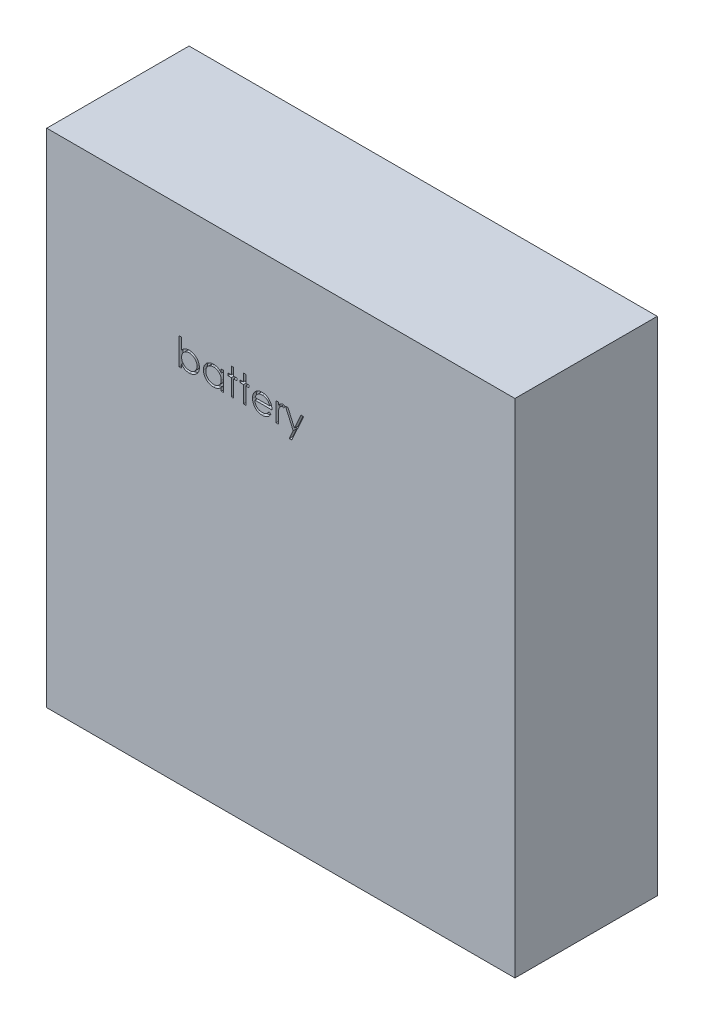
from build123d import *

# Parameters (mm, degrees)
SKETCH1_W           = 62.5
SKETCH1_H           = 67
BOSS_EXTRUDE1_DEPTH = 19
CUT_EXTRUDE1_DEPTH  = 0.5


with BuildPart() as part:
    # Sketch1 → Boss-Extrude1 (new body)
    with BuildSketch(Plane.XY):
        with Locations((31.25, 33.5)):
            Rectangle(SKETCH1_W, SKETCH1_H)
    extrude(amount=BOSS_EXTRUDE1_DEPTH)

    # Sketch2 → Cut-Extrude1 (cut)
    # profile 1 of 7: a face of its own
    with BuildSketch(Plane.XY.offset(19)):
        with BuildLine():
            Line((17.685046553, 48.241424132), (17.685046553, 51.831167722))
            Line((17.685046553, 51.831167722), (17.999149117, 51.831167722))
            Line((17.999149117, 51.831167722), (17.999149117, 50.334973811))
            add(Edge.make_bspline(
                [(17.999149117, 50.334973811), (18.034542536, 50.375731743), (18.103596556, 50.455252149), (18.219373007, 50.559099798), (18.340778576, 50.647152276), (18.468736832, 50.719738394), (18.603429765, 50.775012001), (18.744161874, 50.815434391), (18.891292915, 50.839821294), (18.991612089, 50.842587367), (19.042418348, 50.843988234)],
                knots=[0, 0, 0, 0, 1.077089805, 2.101446609, 3.097517232, 4.067117542, 5.031729543, 5.997785507, 6.985986182, 8, 8, 8, 8], degree=3))
            add(Edge.make_bspline(
                [(19.042418348, 50.843988234), (19.087584486, 50.842748006), (19.176885638, 50.840295864), (19.308167785, 50.821661368), (19.43448106, 50.791443567), (19.555756708, 50.749551387), (19.67142884, 50.69396841), (19.782487897, 50.627427102), (19.888364882, 50.548188773), (19.987419767, 50.457590462), (20.078713654, 50.359233839), (20.158626164, 50.254053524), (20.22612586, 50.143578434), (20.281957153, 50.028178371), (20.325128205, 49.90738202), (20.354870473, 49.781307822), (20.373763937, 49.650079803), (20.376144183, 49.560766999), (20.377354245, 49.515362433)],
                knots=[0, 0, 0, 0, 1.034377878, 2.045141349, 3.03070803, 4.00595497, 4.978199603, 5.965204761, 6.967410914, 8.002051993, 9.036360596, 10.037508045, 11.022711142, 11.997267194, 12.969246472, 13.954813154, 14.960274251, 16, 16, 16, 16], degree=3))
            add(Edge.make_bspline(
                [(20.377354245, 49.515362433), (20.376117805, 49.470662415), (20.373679739, 49.38252102), (20.355058431, 49.252814464), (20.324312166, 49.127975765), (20.280350983, 49.008327507), (20.225086044, 48.893307594), (20.155974768, 48.78422719), (20.076163769, 48.679188214), (19.98383262, 48.581564583), (19.883919068, 48.491331183), (19.777004825, 48.412925318), (19.665782903, 48.345208198), (19.548519791, 48.29155275), (19.426951749, 48.248151829), (19.299776363, 48.218034138), (19.167713135, 48.200461083), (19.077994246, 48.197865516), (19.032602643, 48.196552337)],
                knots=[0, 0, 0, 0, 1.024244038, 2.01964794, 2.996620209, 3.965911562, 4.936179293, 5.91563013, 6.920572822, 7.955171681, 8.990768464, 10.002129126, 10.989675881, 11.969873457, 12.952483066, 13.943799762, 14.959703725, 16, 16, 16, 16], degree=3))
            add(Edge.make_bspline(
                [(19.032602643, 48.196552337), (18.980637531, 48.197992945), (18.878743006, 48.200817727), (18.729690341, 48.224236706), (18.588608791, 48.264098316), (18.453891243, 48.317660072), (18.32746352, 48.390188726), (18.208522938, 48.480145476), (18.097819565, 48.589012613), (18.03260275, 48.672074103), (17.999149117, 48.714681343)],
                knots=[0, 0, 0, 0, 1.035807596, 2.031038093, 2.998900396, 3.954262848, 4.914341711, 5.895762244, 6.92060972, 8, 8, 8, 8], degree=3))
            Line((17.999149117, 48.714681343), (17.999149117, 48.241424132))
            Line((17.999149117, 48.241424132), (17.685046553, 48.241424132))
        make_face()
        with BuildLine():
            add(Edge.make_bspline(
                [(19.029798156, 48.510654901), (19.075712508, 48.51228853), (19.166340137, 48.515513054), (19.299383927, 48.540686677), (19.426698137, 48.582570791), (19.547641219, 48.639854499), (19.660320531, 48.711876534), (19.760973165, 48.799022704), (19.850452875, 48.898524219), (19.925104651, 49.010757912), (19.987430895, 49.130208881), (20.030244171, 49.255863183), (20.058963893, 49.384357972), (20.061816191, 49.471504016), (20.063251681, 49.515362433)],
                knots=[0, 0, 0, 0, 1.031910345, 2.036826888, 3.032245421, 4.038315463, 5.03827337, 6.029480047, 7.023177075, 8.037597977, 9.052889626, 10.043399556, 11.015292101, 12, 12, 12, 12], degree=3))
            add(Edge.make_bspline(
                [(20.063251681, 49.515362433), (20.061363937, 49.559177975), (20.057595986, 49.646634136), (20.031221203, 49.776283803), (19.985163413, 49.901871428), (19.92404539, 50.023049416), (19.848177405, 50.136057217), (19.759171441, 50.237547344), (19.657289635, 50.325107328), (19.544466216, 50.398097399), (19.424286025, 50.457656952), (19.297795392, 50.498501978), (19.167637269, 50.525240165), (19.079241776, 50.528329293), (19.034706008, 50.52988567)],
                knots=[0, 0, 0, 0, 0.984795267, 1.965658976, 2.959410029, 3.983795688, 5.009594896, 6.01088574, 7.009236619, 8.019050059, 9.024672985, 10.014834719, 10.999826153, 12, 12, 12, 12], degree=3))
            add(Edge.make_bspline(
                [(19.034706008, 50.52988567), (18.989238501, 50.528330173), (18.898994724, 50.525242826), (18.765826502, 50.498455002), (18.635763218, 50.457407391), (18.511475686, 50.398476041), (18.395621631, 50.326364581), (18.292009019, 50.241624381), (18.202677461, 50.144844473), (18.12913369, 50.036338671), (18.070728891, 49.919153636), (18.028945143, 49.794141433), (18.003945497, 49.66196012), (18.000767364, 49.571326915), (17.999149117, 49.525178138)],
                knots=[0, 0, 0, 0, 1.016820015, 2.018181405, 3.029022337, 4.06341356, 5.088169224, 6.076823655, 7.05054209, 8.02560866, 9.001194327, 9.972267242, 10.967515442, 12, 12, 12, 12], degree=3))
            add(Edge.make_bspline(
                [(17.999149117, 49.525178138), (18.000108788, 49.48984032), (18.001997723, 49.42028431), (18.016428091, 49.31815662), (18.039383753, 49.220423527), (18.071727247, 49.126978532), (18.114228482, 49.038352092), (18.165438747, 48.953856012), (18.226390394, 48.874252734), (18.295296983, 48.799737414), (18.371259364, 48.731927999), (18.452782483, 48.673149774), (18.538200414, 48.622535584), (18.628490384, 48.582190742), (18.722601675, 48.549264221), (18.821500016, 48.527530475), (18.92417144, 48.512555436), (18.994218538, 48.511295083), (19.029798156, 48.510654901)],
                knots=[0, 0, 0, 0, 1.050331198, 2.067384183, 3.060053655, 4.031335885, 5.001026174, 5.976994447, 6.963687968, 7.976578778, 8.990422448, 9.985569286, 10.960374351, 11.936812464, 12.921228065, 13.919088064, 14.943024695, 16, 16, 16, 16], degree=3))
        make_face(mode=Mode.SUBTRACT)
    # profile 2 of 7: a face of its own
    with BuildSketch(Plane.XY.offset(19)):
        with BuildLine():
            Line((23.608123476, 50.79911644), (23.608123476, 48.241424132))
            Line((23.608123476, 48.241424132), (23.294020912, 48.241424132))
            Line((23.294020912, 48.241424132), (23.294020912, 48.683831984))
            add(Edge.make_bspline(
                [(23.294020912, 48.683831984), (23.258602121, 48.643792391), (23.189481906, 48.565654619), (23.074040788, 48.463572447), (22.95167261, 48.379194125), (22.822971289, 48.31104421), (22.688053046, 48.259852153), (22.547216959, 48.223465994), (22.400405578, 48.200072159), (22.300153223, 48.197736137), (22.249349438, 48.196552337)],
                knots=[0, 0, 0, 0, 1.074387032, 2.096679803, 3.090159297, 4.057316773, 5.018401886, 5.985159533, 6.978961417, 8, 8, 8, 8], degree=3))
            add(Edge.make_bspline(
                [(22.249349438, 48.196552337), (22.204181484, 48.197778709), (22.115108279, 48.20019717), (21.984079202, 48.218959473), (21.857986952, 48.249090095), (21.73671238, 48.290990984), (21.621040234, 48.346571806), (21.509980138, 48.413113054), (21.404107446, 48.492353884), (21.305035907, 48.582941913), (21.213803906, 48.6813369), (21.133742634, 48.786282447), (21.066989554, 48.897324751), (21.011169473, 49.013057904), (20.968173129, 49.134372824), (20.938199494, 49.260849992), (20.919459048, 49.392339865), (20.917041587, 49.481879389), (20.915815784, 49.527281504)],
                knots=[0, 0, 0, 0, 1.033919861, 2.038935746, 3.024066025, 3.998881131, 4.97069526, 5.957263378, 6.95902576, 7.993208707, 9.027059324, 10.027763471, 11.009749337, 11.988697705, 12.965288445, 13.950418724, 14.960734635, 16, 16, 16, 16], degree=3))
            add(Edge.make_bspline(
                [(20.915815784, 49.527281504), (20.917068755, 49.571745207), (20.919545812, 49.659647551), (20.937999032, 49.788926249), (20.969030041, 49.913444509), (21.012577888, 50.032801453), (21.068419843, 50.147141503), (21.13634793, 50.256545528), (21.216367055, 50.361314925), (21.308619462, 50.458986152), (21.408554232, 50.549206766), (21.515462963, 50.627615812), (21.626686244, 50.695332661), (21.743949255, 50.748986137), (21.86551636, 50.792395241), (21.992469805, 50.822428209), (22.124281384, 50.840125531), (22.213771876, 50.842688295), (22.259165143, 50.843988234)],
                knots=[0, 0, 0, 0, 1.020392517, 2.01726096, 2.990465484, 3.961182959, 4.928053699, 5.906110375, 6.912531644, 7.948652711, 8.985773172, 9.998621852, 10.987621588, 11.969261332, 12.953316658, 13.946091881, 14.958173133, 16, 16, 16, 16], degree=3))
            add(Edge.make_bspline(
                [(22.259165143, 50.843988234), (22.311365002, 50.842550483), (22.413726462, 50.83973112), (22.563454471, 50.816268393), (22.705098949, 50.776629926), (22.839753301, 50.722712428), (22.966933987, 50.651063698), (23.085436971, 50.560683737), (23.196502455, 50.45214255), (23.260882746, 50.368772106), (23.294020912, 50.325859228)],
                knots=[0, 0, 0, 0, 1.038897134, 2.037228247, 3.008116434, 3.962042015, 4.918381754, 5.904844433, 6.921570401, 8, 8, 8, 8], degree=3))
            Line((23.294020912, 50.325859228), (23.294020912, 50.79911644))
            Line((23.294020912, 50.79911644), (23.608123476, 50.79911644))
        make_face()
        with BuildLine():
            add(Edge.make_bspline(
                [(22.263371874, 50.52988567), (22.217457536, 50.528252033), (22.126829936, 50.525027492), (21.993785934, 50.499853996), (21.86647252, 50.457969402), (21.745526445, 50.400687501), (21.632858229, 50.328658764), (21.532164558, 50.241537381), (21.442621857, 50.141700367), (21.367313592, 50.029598256), (21.305923095, 49.909420165), (21.262756063, 49.783795727), (21.234286816, 49.65499075), (21.231378295, 49.567628064), (21.229918348, 49.523775895)],
                knots=[0, 0, 0, 0, 1.031046209, 2.035121221, 3.029706178, 4.034933723, 5.034054252, 6.02443088, 7.017295772, 8.038157696, 9.050218397, 10.03989886, 11.016116709, 12, 12, 12, 12], degree=3))
            add(Edge.make_bspline(
                [(21.229918348, 49.523775895), (21.231783241, 49.480185788), (21.235505718, 49.393176432), (21.262256413, 49.264195855), (21.307136286, 49.138541813), (21.368378349, 49.017280819), (21.445064973, 48.904696719), (21.533953626, 48.802956596), (21.635903907, 48.715467008), (21.748831414, 48.642229435), (21.869439385, 48.583066914), (21.996273316, 48.541901274), (22.126948954, 48.515323494), (22.215801288, 48.512219017), (22.260567386, 48.510654901)],
                knots=[0, 0, 0, 0, 0.979072187, 1.954306742, 2.945804271, 3.96968567, 4.997920485, 5.998718438, 6.996577872, 8.005894225, 9.015743152, 10.005417472, 10.995077863, 12, 12, 12, 12], degree=3))
            add(Edge.make_bspline(
                [(22.260567386, 48.510654901), (22.306013889, 48.512314865), (22.396402476, 48.515616369), (22.529841184, 48.540897634), (22.659336146, 48.582666432), (22.783123375, 48.640565559), (22.898439506, 48.712322915), (23.001937384, 48.796330006), (23.089453352, 48.89403319), (23.163645961, 49.001409643), (23.221821378, 49.11912164), (23.264197437, 49.24445583), (23.289251343, 49.377416579), (23.292409073, 49.468280505), (23.294020912, 49.514661311)],
                knots=[0, 0, 0, 0, 1.01762866, 2.023962475, 3.030623092, 4.058876274, 5.077231937, 6.066672613, 7.034107872, 8.005628644, 8.981990164, 9.965428785, 10.961468474, 12, 12, 12, 12], degree=3))
            add(Edge.make_bspline(
                [(23.294020912, 49.514661311), (23.293061256, 49.549999142), (23.291172348, 49.619555175), (23.276741779, 49.721682693), (23.253786852, 49.819416419), (23.221440682, 49.912859108), (23.178949398, 50.001494123), (23.127701632, 50.085957884), (23.066796182, 50.165811095), (22.997213486, 50.239954166), (22.921048284, 50.307580628), (22.840453743, 50.367944869), (22.754474996, 50.417533642), (22.664557959, 50.458574913), (22.570546625, 50.491234063), (22.471676005, 50.513021757), (22.368997018, 50.527982078), (22.298950962, 50.529244459), (22.263371874, 50.52988567)],
                knots=[0, 0, 0, 0, 1.050140795, 2.067009409, 3.05949893, 4.030605086, 5.00011959, 5.97591094, 6.962425594, 7.979863591, 8.993523472, 9.986985069, 10.967611495, 11.937549037, 12.921786183, 13.919465291, 14.943216303, 16, 16, 16, 16], degree=3))
        make_face(mode=Mode.SUBTRACT)
    # profile 3 of 7: a face of its own
    with BuildSketch(Plane.XY.offset(19)):
        Polygon((24.640174758, 51.831167722), (24.954277322, 51.831167722), (24.954277322, 50.79911644), (25.402995271, 50.79911644), (25.402995271, 50.485013876), (24.954277322, 50.485013876), (24.954277322, 48.241424132), (24.640174758, 48.241424132), (24.640174758, 50.485013876), (24.191456809, 50.485013876), (24.191456809, 50.79911644), (24.640174758, 50.79911644), align=None)
    # profile 4 of 7: a face of its own
    with BuildSketch(Plane.XY.offset(19)):
        Polygon((26.255559374, 51.831167722), (26.569661938, 51.831167722), (26.569661938, 50.79911644), (27.018379886, 50.79911644), (27.018379886, 50.485013876), (26.569661938, 50.485013876), (26.569661938, 48.241424132), (26.255559374, 48.241424132), (26.255559374, 50.485013876), (25.806841425, 50.485013876), (25.806841425, 50.79911644), (26.255559374, 50.79911644), align=None)
    # profile 5 of 7: a face of its own
    with BuildSketch(Plane.XY.offset(19)):
        with BuildLine():
            Line((29.656000079, 49.04911644), (29.935046553, 48.902581984))
            add(Edge.make_bspline(
                [(29.935046553, 48.902581984), (29.912809958, 48.863138653), (29.869546349, 48.78639755), (29.795145601, 48.68096569), (29.717153529, 48.586117974), (29.632049561, 48.50438832), (29.542379882, 48.433136935), (29.447647227, 48.37079911), (29.347358409, 48.31768059), (29.241508685, 48.272928062), (29.129209133, 48.238518568), (29.010187617, 48.214214347), (28.884216122, 48.199191078), (28.797869942, 48.197445937), (28.753656329, 48.196552337)],
                knots=[0, 0, 0, 0, 1.120438281, 2.179929193, 3.190490725, 4.156257408, 5.095198341, 6.022838206, 6.959905092, 7.901321166, 8.864066838, 9.862729781, 10.905609505, 12, 12, 12, 12], degree=3))
            add(Edge.make_bspline(
                [(28.753656329, 48.196552337), (28.704514351, 48.197699512), (28.60865259, 48.199937319), (28.469112842, 48.219229784), (28.337733424, 48.250702142), (28.214521721, 48.294667684), (28.099779468, 48.352095008), (27.993278613, 48.42205449), (27.894459087, 48.504186744), (27.806434878, 48.599203188), (27.727190996, 48.700885145), (27.657265176, 48.80684103), (27.598807744, 48.916804254), (27.551255134, 49.030074778), (27.512850269, 49.145938672), (27.486083566, 49.265450139), (27.470653818, 49.388285723), (27.468289372, 49.471383059), (27.467097835, 49.513259068)],
                knots=[0, 0, 0, 0, 1.145258523, 2.234067595, 3.276747158, 4.290159414, 5.277019952, 6.260822364, 7.254936242, 8.264827045, 9.274100331, 10.257902744, 11.220704747, 12.172965371, 13.118907548, 14.062713208, 15.023725156, 16, 16, 16, 16], degree=3))
            add(Edge.make_bspline(
                [(27.467097835, 49.513259068), (27.468156976, 49.552553898), (27.470256055, 49.630431063), (27.483486842, 49.745696607), (27.506935135, 49.85772506), (27.539111459, 49.966609508), (27.580662705, 50.072167642), (27.631494925, 50.174463706), (27.691687302, 50.273388845), (27.738159976, 50.335791979), (27.761568989, 50.367225414)],
                knots=[0, 0, 0, 0, 1.024358464, 2.0301432, 3.019427413, 4.004406732, 4.986367066, 5.972626655, 6.978780325, 8, 8, 8, 8], degree=3))
            add(Edge.make_bspline(
                [(27.761568989, 50.367225414), (27.793276672, 50.405094284), (27.855687618, 50.479632435), (27.961243974, 50.57757076), (28.07554417, 50.659614535), (28.197155796, 50.727621672), (28.32749227, 50.779295319), (28.464801561, 50.817802901), (28.610647147, 50.839380912), (28.710352368, 50.842428745), (28.761368668, 50.843988234)],
                knots=[0, 0, 0, 0, 1.030682036, 2.02871468, 2.997146059, 3.962720338, 4.930598197, 5.918074684, 6.934738563, 8, 8, 8, 8], degree=3))
            add(Edge.make_bspline(
                [(28.761368668, 50.843988234), (28.813816274, 50.842634186), (28.91670652, 50.83997785), (29.066738641, 50.815351517), (29.208699357, 50.776298962), (29.342531862, 50.721145172), (29.468249722, 50.64998562), (29.585035772, 50.561843779), (29.694887284, 50.459425691), (29.758795863, 50.380662482), (29.791316585, 50.340582786)],
                knots=[0, 0, 0, 0, 1.056321875, 2.072262726, 3.055038591, 4.01806755, 4.982017516, 5.957941055, 6.960871419, 8, 8, 8, 8], degree=3))
            add(Edge.make_bspline(
                [(29.791316585, 50.340582786), (29.813443523, 50.310379204), (29.857550117, 50.250173086), (29.912797217, 50.152001929), (29.960754612, 50.049291334), (29.999087573, 49.940381037), (30.030127074, 49.826561457), (30.052583893, 49.707018912), (30.065753511, 49.581789001), (30.068342208, 49.496462445), (30.069661938, 49.452962593)],
                knots=[0, 0, 0, 0, 0.94817472, 1.890038105, 2.849395472, 3.817997239, 4.812318967, 5.836947057, 6.897266129, 8, 8, 8, 8], degree=3))
            Line((30.069661938, 49.452962593), (27.781200399, 49.452962593))
            add(Edge.make_bspline(
                [(27.781200399, 49.452962593), (27.782740006, 49.419262129), (27.78576758, 49.352991525), (27.799882723, 49.256020742), (27.822131497, 49.1636474), (27.853400559, 49.076564358), (27.891267404, 48.993634231), (27.937653121, 48.915472194), (27.992992675, 48.842434264), (28.054718375, 48.773867126), (28.12342547, 48.712806365), (28.195708217, 48.658154589), (28.272601782, 48.612348992), (28.353499866, 48.575169102), (28.438271651, 48.546062786), (28.526943846, 48.526194965), (28.619341962, 48.512887859), (28.682327696, 48.511408193), (28.714393508, 48.510654901)],
                knots=[0, 0, 0, 0, 1.094153842, 2.151609401, 3.174256925, 4.172055639, 5.149267565, 6.128595816, 7.11444997, 8.118368179, 9.117203808, 10.09244225, 11.054858984, 12.015122123, 12.976791628, 13.957293641, 14.960065497, 16, 16, 16, 16], degree=3))
            add(Edge.make_bspline(
                [(28.714393508, 48.510654901), (28.745744656, 48.511262958), (28.807951347, 48.512469459), (28.900592204, 48.52420137), (28.991731731, 48.543171645), (29.080992715, 48.569061635), (29.166563561, 48.600638488), (29.245809111, 48.638741345), (29.318689326, 48.680891092), (29.386806293, 48.729100767), (29.452877286, 48.788108954), (29.518419773, 48.861744675), (29.588696426, 48.948832203), (29.632686019, 49.014377869), (29.656000079, 49.04911644)],
                knots=[0, 0, 0, 0, 0.99110716, 1.966546729, 2.947904876, 3.932708344, 4.903319531, 5.828989031, 6.710028674, 7.56322171, 8.463672341, 9.504779593, 10.677557249, 12, 12, 12, 12], degree=3))
        make_face()
        with BuildLine():
            add(Edge.make_bspline(
                [(29.755559374, 49.767065158), (29.744062749, 49.808728031), (29.721935448, 49.888915652), (29.675699083, 49.999956542), (29.623627542, 50.098644443), (29.562005811, 50.184224076), (29.492187085, 50.260227589), (29.411541903, 50.326646175), (29.321106009, 50.386063626), (29.221346869, 50.436216125), (29.115705084, 50.478905984), (29.005098892, 50.5075311), (28.892241104, 50.527140642), (28.815906817, 50.52896675), (28.77749447, 50.52988567)],
                knots=[0, 0, 0, 0, 1.154881502, 2.222775134, 3.210006277, 4.132804581, 5.035138423, 5.962687519, 6.919655026, 7.923214229, 8.944639381, 9.960483929, 10.97369054, 12, 12, 12, 12], degree=3))
            add(Edge.make_bspline(
                [(28.77749447, 50.52988567), (28.746145031, 50.529273999), (28.684173782, 50.528064853), (28.592872714, 50.516594723), (28.505193015, 50.497634879), (28.420487727, 50.471669922), (28.339866859, 50.437061319), (28.261672091, 50.396478093), (28.187891695, 50.346936509), (28.141750399, 50.309177654), (28.118439983, 50.290102017)],
                knots=[0, 0, 0, 0, 1.04873581, 2.073130211, 3.073294108, 4.04793562, 5.032784715, 6.005352987, 6.992311501, 8, 8, 8, 8], degree=3))
            add(Edge.make_bspline(
                [(28.118439983, 50.290102017), (28.101746701, 50.275007701), (28.067963566, 50.244460485), (28.022823045, 50.191831278), (27.979602572, 50.135079716), (27.940268919, 50.072034592), (27.904191333, 50.003413813), (27.870431356, 49.929796177), (27.840044944, 49.850623047), (27.822948834, 49.795450608), (27.814153124, 49.767065158)],
                knots=[0, 0, 0, 0, 0.879870761, 1.780643979, 2.707998968, 3.669668524, 4.684282772, 5.740141944, 6.837334558, 8, 8, 8, 8], degree=3))
            Line((27.814153124, 49.767065158), (29.755559374, 49.767065158))
        make_face(mode=Mode.SUBTRACT)
    # profile 6 of 7: a face of its own
    with BuildSketch(Plane.XY.offset(19)):
        with BuildLine():
            Line((30.608123476, 50.79911644), (30.92222604, 50.79911644))
            Line((30.92222604, 50.79911644), (30.92222604, 50.422614036))
            add(Edge.make_bspline(
                [(30.92222604, 50.422614036), (30.945414799, 50.457669864), (30.98976312, 50.524713863), (31.063476049, 50.613383164), (31.138979381, 50.686798211), (31.216634568, 50.74530173), (31.297012668, 50.789114849), (31.37834962, 50.821207884), (31.461925089, 50.840185199), (31.518087014, 50.842718858), (31.546224438, 50.843988234)],
                knots=[0, 0, 0, 0, 1.2804753, 2.448899062, 3.506932113, 4.484331642, 5.4025378, 6.288909075, 7.142734305, 8, 8, 8, 8], degree=3))
            add(Edge.make_bspline(
                [(31.546224438, 50.843988234), (31.568050764, 50.842797708), (31.612959849, 50.840348122), (31.680942439, 50.823137297), (31.750985891, 50.795659275), (31.796128278, 50.769819052), (31.819661938, 50.75634801)],
                knots=[0, 0, 0, 0, 0.901110191, 1.854092781, 2.881294221, 4, 4, 4, 4], degree=3))
            Line((31.819661938, 50.75634801), (31.647185976, 50.484312754))
            add(Edge.make_bspline(
                [(31.647185976, 50.484312754), (31.632076955, 50.49105302), (31.60339714, 50.503847335), (31.561442574, 50.518989345), (31.522761237, 50.527905261), (31.498117679, 50.529255979), (31.486629085, 50.52988567)],
                knots=[0, 0, 0, 0, 1.180555205, 2.24091978, 3.179933427, 4, 4, 4, 4], degree=3))
            add(Edge.make_bspline(
                [(31.486629085, 50.52988567), (31.461423352, 50.528205633), (31.410010962, 50.524778844), (31.334526462, 50.497840036), (31.261279257, 50.454314796), (31.203107594, 50.406043684), (31.158065342, 50.359495887), (31.125925116, 50.318847484), (31.096442369, 50.273268852), (31.068272149, 50.223539169), (31.042605854, 50.168809323), (31.018651185, 50.109626109), (30.996992322, 50.04592098), (30.984642078, 50.00153846), (30.978315784, 49.97880394)],
                knots=[0, 0, 0, 0, 1.125678352, 2.296057538, 3.5422874, 4.923748041, 5.663163013, 6.437101912, 7.23742474, 8.08941207, 8.991984279, 9.93940061, 10.944477711, 12, 12, 12, 12], degree=3))
            add(Edge.make_bspline(
                [(30.978315784, 49.97880394), (30.97358339, 49.958526766), (30.963101499, 49.913614367), (30.952909961, 49.838265843), (30.942840443, 49.749242184), (30.935743825, 49.646295591), (30.929165782, 49.529683147), (30.9254557, 49.399227201), (30.92235256, 49.25479385), (30.922269493, 49.153819497), (30.92222604, 49.100999452)],
                knots=[0, 0, 0, 0, 0.566838948, 1.255505196, 2.06880316, 3.007127437, 4.065329342, 5.249902469, 6.561414163, 8, 8, 8, 8], degree=3))
            Line((30.92222604, 49.100999452), (30.92222604, 48.241424132))
            Line((30.92222604, 48.241424132), (30.608123476, 48.241424132))
            Line((30.608123476, 48.241424132), (30.608123476, 50.79911644))
        make_face()
    # profile 7 of 7: a face of its own
    with BuildSketch(Plane.XY.offset(19)):
        Polygon((31.864533733, 50.79911644), (32.202474438, 50.79911644), (33.069762098, 48.840182145), (33.948267707, 50.79911644), (34.287610656, 50.79911644), (32.717097835, 47.29911644), (32.377754886, 47.29911644), (32.900090624, 48.460875254), align=None)
    extrude(amount=-CUT_EXTRUDE1_DEPTH, mode=Mode.SUBTRACT)


solid = part.part
